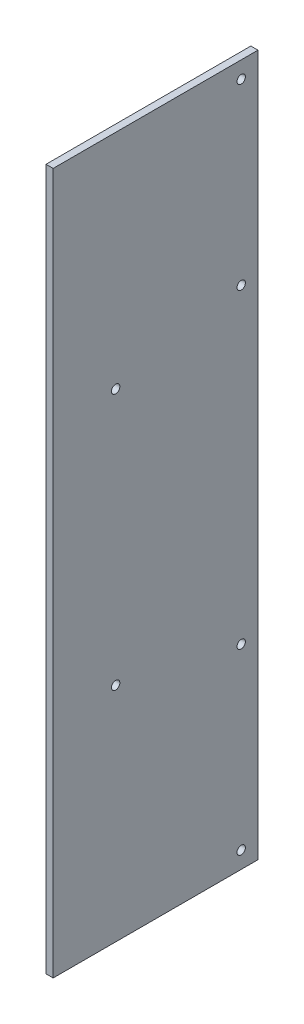
from build123d import *

# Parameters (mm, degrees)
SKETCH1_W           = 163.28644
SKETCH1_H           = 160.3502
SKETCH1_R           = 3.175
BOSS_EXTRUDE3_DEPTH = 5.4102
SKETCH5_W           = 163.28644
SKETCH5_H           = 369.98656
SKETCH5_R           = 3.175
BOSS_EXTRUDE7_DEPTH = 5.4102
SKETCH6_W           = 8.34644
SKETCH6_H           = 530.33676
CUT_EXTRUDE1_DEPTH  = 5.4102
SKETCH7_R           = 3.175
CUT_EXTRUDE2_DEPTH  = 5.4102


with BuildPart() as part:
    # Sketch1 → Boss-Extrude3 (new body)
    with BuildSketch(Plane(origin=(0, 0, 0), x_dir=(0, 0, -1), z_dir=(1, 0, 0))):
        with Locations((73.29678, -80.1751)):
            Rectangle(SKETCH1_W, SKETCH1_H)
        with Locations((142.24, -147.6502)):
            Circle(SKETCH1_R, mode=Mode.SUBTRACT)
        with Locations((142.24, -12.7)):
            Circle(SKETCH1_R, mode=Mode.SUBTRACT)
    extrude(amount=BOSS_EXTRUDE3_DEPTH)

    # Sketch5 → Boss-Extrude7 (add)
    with BuildSketch(Plane(origin=(5.4102, 0, 0), x_dir=(0, 0, -1), z_dir=(1, 0, 0))):
        with Locations((73.29678, -345.34348)):
            Rectangle(SKETCH5_W, SKETCH5_H)
        with Locations((47.27956, -362.18876)):
            Circle(SKETCH5_R, mode=Mode.SUBTRACT)
        with Locations((47.27956, -168.148)):
            Circle(SKETCH5_R, mode=Mode.SUBTRACT)
    extrude(amount=-BOSS_EXTRUDE7_DEPTH)

    # Sketch6 → Cut-Extrude1 (cut)
    with BuildSketch(Plane.ZY):
        with Locations((4.17322, -265.16838)):
            Rectangle(SKETCH6_W, SKETCH6_H)
    extrude(amount=-CUT_EXTRUDE1_DEPTH, mode=Mode.SUBTRACT)

    # Sketch7 → Cut-Extrude2 (cut)
    with BuildSketch(Plane.ZY):
        with Locations((-142.24, -517.63676)):
            Circle(SKETCH7_R)
        with Locations((-142.24, -382.76276)):
            Circle(SKETCH7_R)
    extrude(amount=-CUT_EXTRUDE2_DEPTH, mode=Mode.SUBTRACT)


solid = part.part
